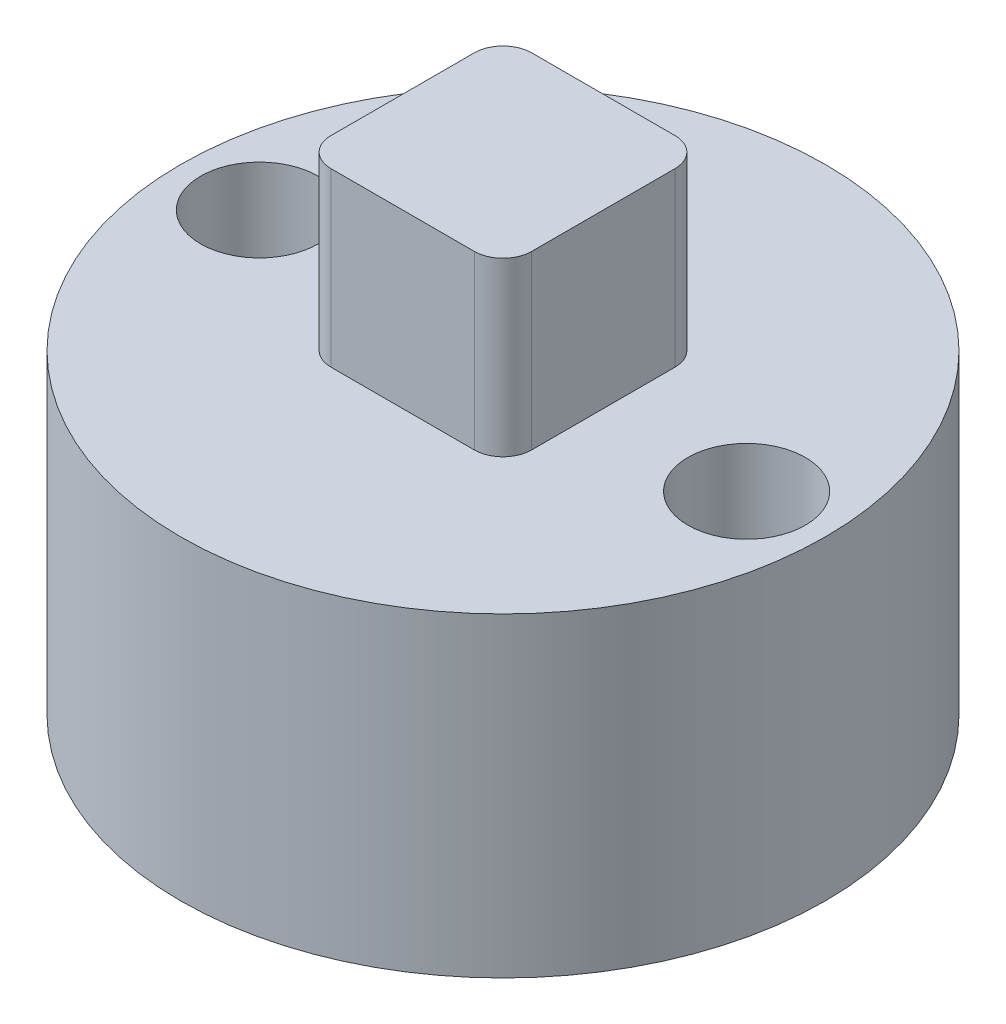
from build123d import *

# Parameters (mm, degrees)
SKETCH_1_R          = 11.25
EXTRUDE_1_DEPTH     = 11
SKETCH_2_R          = 1.15
CUT_EXTRUDE_1_DEPTH = 20.342311134
SKETCH_4_W          = 7
SKETCH_4_H          = 7
EXTRUDE_3_DEPTH     = 6
SKETCH_5_R          = 2.05
CUT_EXTRUDE_2_DEPTH = 9.5
FILLET_1_R          = 1


with BuildPart() as part:
    # 草图1 → 凸台-拉伸1 (new body)
    with BuildSketch(Plane(origin=(0, 0, 0), x_dir=(1, 0, 0), z_dir=(0, 1, 0))):
        with Locations(Location((0, 0, 0), (0, 0, 270))):
            Circle(SKETCH_1_R)
    extrude(amount=EXTRUDE_1_DEPTH)

    # 草图2 → 切除-拉伸1 (cut, through all)
    with BuildSketch(Plane.XZ):
        with Locations(Location((8.5, 0, 0), (0, 0, 270))):
            Circle(SKETCH_2_R)
        with Locations(Location((-8.5, 0, 0), (0, 0, 90))):
            Circle(SKETCH_2_R)
    extrude(amount=-CUT_EXTRUDE_1_DEPTH, mode=Mode.SUBTRACT)

    # 草图4 → 凸台-拉伸3 (add)
    with BuildSketch(Plane(origin=(0, 11, 0), x_dir=(1, 0, 0), z_dir=(0, 1, 0))):
        Rectangle(SKETCH_4_W, SKETCH_4_H)
    extrude(amount=EXTRUDE_3_DEPTH)

    # 草图5 → 切除-拉伸2 (cut)
    with BuildSketch(Plane(origin=(0, 11, 0), x_dir=(1, 0, 0), z_dir=(0, 1, 0))):
        with Locations(Location((8.5, 0, 0), (0, 0, 270))):
            Circle(SKETCH_5_R)
        with Locations(Location((-8.5, 0, 0), (0, 0, 270))):
            Circle(SKETCH_5_R)
    extrude(amount=-CUT_EXTRUDE_2_DEPTH, mode=Mode.SUBTRACT)

    # 圆角1
    fillet_1_edges = [part.edges().sort_by_distance(p)[0] for p in [
        (3.5, 14, 3.5),
        (3.5, 14, -3.5),
        (-3.5, 14, -3.5),
        (-3.5, 14, 3.5),
    ]]
    fillet(fillet_1_edges, radius=FILLET_1_R)


solid = part.part
